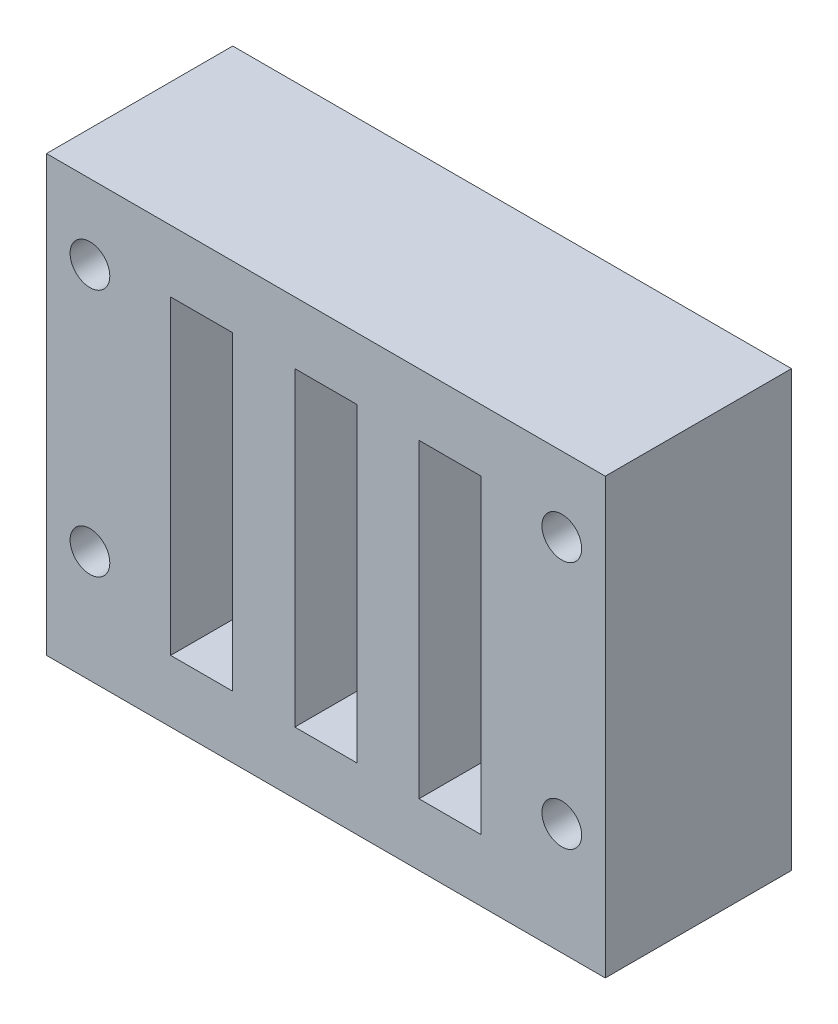
from build123d import *

# Parameters (mm, degrees)
SKETCH_1_W          = 45
SKETCH_1_H          = 35
SKETCH_1_R          = 1.6
EXTRUDE_1_DEPTH     = 15
SKETCH_2_W          = 5
SKETCH_2_H          = 25
CUT_EXTRUDE_2_DEPTH = 15


with BuildPart() as part:
    # 草图1 → 凸台-拉伸1 (new body)
    with BuildSketch(Plane.XY):
        with Locations((0, -1.5)):
            Rectangle(SKETCH_1_W, SKETCH_1_H)
        with Locations((-19, 10)):
            Circle(SKETCH_1_R, mode=Mode.SUBTRACT)
        with Locations((19, 10)):
            Circle(SKETCH_1_R, mode=Mode.SUBTRACT)
        with Locations((19, -10)):
            Circle(SKETCH_1_R, mode=Mode.SUBTRACT)
        with Locations((-19, -10)):
            Circle(SKETCH_1_R, mode=Mode.SUBTRACT)
    extrude(amount=EXTRUDE_1_DEPTH)

    # 草图2 → 切除-拉伸-薄壁2 (cut)
    with BuildSketch(Plane.XY):
        with Locations((0, -1.5)):
            Rectangle(SKETCH_2_W, SKETCH_2_H)
        with Locations((10, -1.5)):
            Rectangle(SKETCH_2_W, SKETCH_2_H)
        with Locations((-10, -1.5)):
            Rectangle(SKETCH_2_W, SKETCH_2_H)
    extrude(amount=CUT_EXTRUDE_2_DEPTH, mode=Mode.SUBTRACT)


solid = part.part
